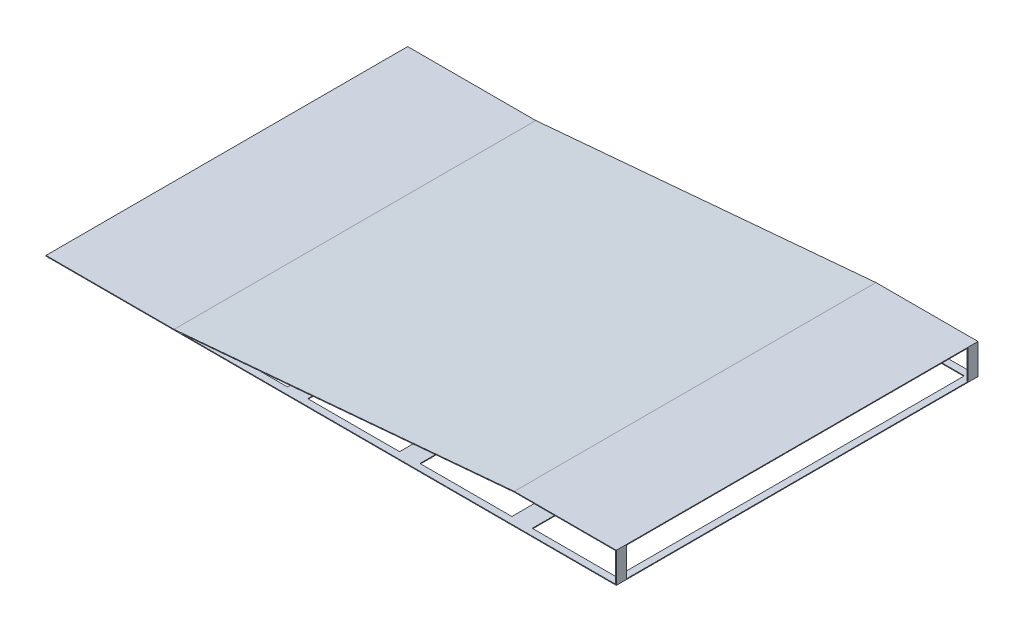
from build123d import *

# Parameters (mm, degrees)
BOSS_EXTRUDE1_DEPTH = 5316
CUT_EXTRUDE1_DEPTH  = 9937.114319617
SKETCH3_W           = 1350
SKETCH3_H           = 5116
SKETCH3_W_2         = 1235.262867543
CUT_EXTRUDE2_DEPTH  = 10
SKETCH5_W           = 5016
SKETCH5_H           = 427.44331763
CUT_EXTRUDE4_DEPTH  = 100


with BuildPart() as part:
    # Sketch1 → Boss-Extrude1 (new body)
    with BuildSketch(Plane.XY):
        Polygon((6882.5, 447.44331763), (1882.5, 10), (0, 10), (0, 0), (8382.5, 0), (8382.5, 447.44331763), align=None)
    extrude(amount=BOSS_EXTRUDE1_DEPTH)

    # Sketch2 → Cut-Extrude1 (cut, through all)
    with BuildSketch(Plane.XY.offset(5316)):
        Polygon((8372.5, 10), (8372.5, 437.44331763), (6882.936609429, 437.44331763), (1997.237132457, 10), align=None)
    extrude(amount=-CUT_EXTRUDE1_DEPTH, mode=Mode.SUBTRACT)

    # Sketch3 → Cut-Extrude2 (cut)
    with BuildSketch(Plane.XZ):
        with Locations((4422.237132457, 2658)):
            Rectangle(SKETCH3_W, SKETCH3_H)
        with Locations((6072.237132457, 2658)):
            Rectangle(SKETCH3_W, SKETCH3_H)
        with Locations((2772.237132457, 2658)):
            Rectangle(SKETCH3_W, SKETCH3_H)
        with Locations((7664.868566229, 2658)):
            Rectangle(SKETCH3_W_2, SKETCH3_H)
    extrude(amount=-CUT_EXTRUDE2_DEPTH, mode=Mode.SUBTRACT)

    # Sketch5 → Cut-Extrude4 (cut)
    with BuildSketch(Plane(origin=(8382.5, 0, 0), x_dir=(0, 0, -1), z_dir=(1, 0, 0))):
        with Locations((-2658, 223.721658815)):
            Rectangle(SKETCH5_W, SKETCH5_H)
    extrude(amount=-CUT_EXTRUDE4_DEPTH, mode=Mode.SUBTRACT)


solid = part.part
